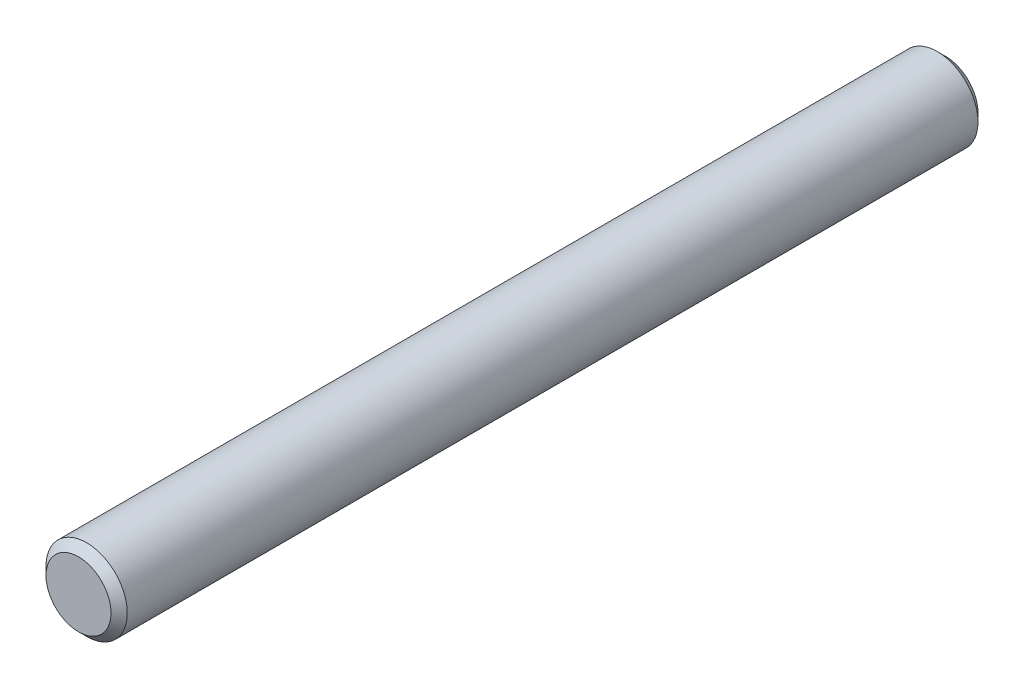
from build123d import *

# Parameters (mm, degrees)
BOSS_EXTRUDE1_DEPTH      = 25.4
BOSS_EXTRUDE1_DEPTH_BACK = 25.4
SKETCH3_R                = 2.38125
CHAMFER1_SIZE            = 0.47625


with BuildPart() as part:
    # Sketch3 → Boss-Extrude1 (new, two sides: drawn at the far end of the back side and taken through both)
    with BuildSketch(Plane.XY.offset(-BOSS_EXTRUDE1_DEPTH_BACK)):
        Circle(SKETCH3_R)
    extrude(amount=BOSS_EXTRUDE1_DEPTH + BOSS_EXTRUDE1_DEPTH_BACK)

    # Chamfer1
    chamfer1_edges = [part.edges().sort_by_distance(p)[0] for p in [
        (-2.38125, 0, -25.4),
        (-2.38125, 0, 25.4),
    ]]
    chamfer(chamfer1_edges, length=CHAMFER1_SIZE)


solid = part.part
